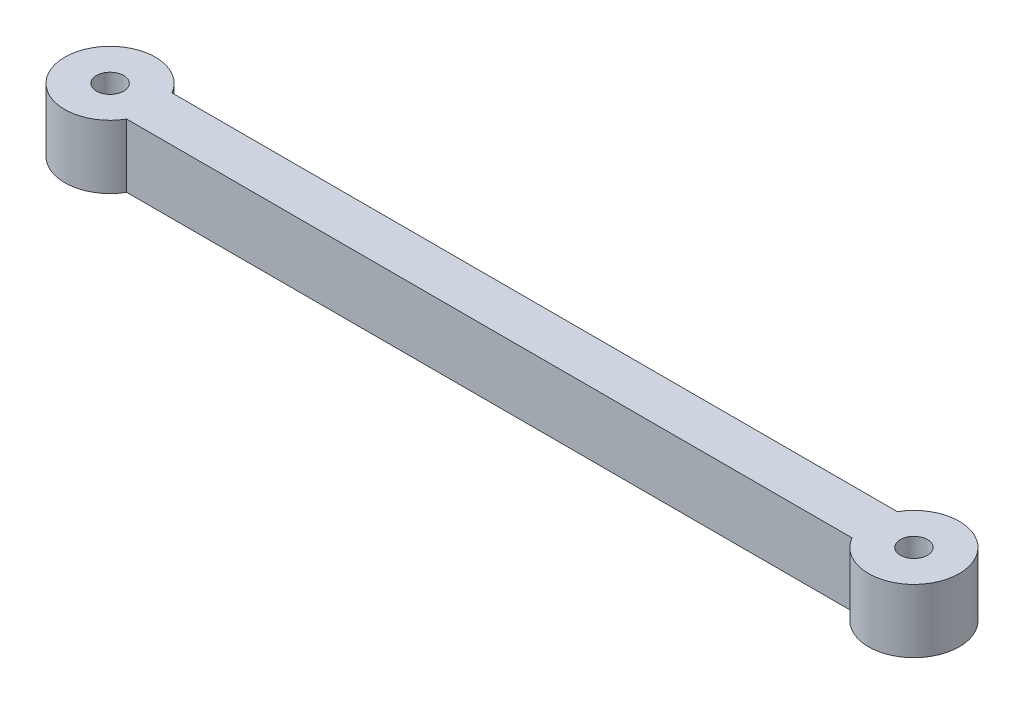
from build123d import *

# Parameters (mm, degrees)
BOSS_EXTRUDE1_DEPTH = 7
SKETCH2_R           = 1.5
CUT_EXTRUDE1_DEPTH  = 51.074558727


with BuildPart() as part:
    # Sketch1 → Boss-Extrude1 (new body)
    with BuildSketch(Plane(origin=(0, 0, 0), x_dir=(1, 0, 0), z_dir=(0, 1, 0))):
        with BuildLine():
            Line((-40, 2.5), (40, 2.5))
            ThreePointArc((40, 2.5), (49.330127019, 0), (40, -2.5))
            Line((40, -2.5), (-40, -2.5))
            ThreePointArc((-40, -2.5), (-49.330127019, 0), (-40, 2.5))
        make_face()
    extrude(amount=BOSS_EXTRUDE1_DEPTH)

    # Sketch2 → Cut-Extrude1 (cut, through all)
    with BuildSketch(Plane(origin=(0, 7, 0), x_dir=(1, 0, 0), z_dir=(0, 1, 0))):
        with Locations(Location((-44.330127019, 0, 0), (0, 0, 270))):
            Circle(SKETCH2_R)
        with Locations(Location((44.330127019, 0, 0), (0, 0, 270))):
            Circle(SKETCH2_R)
    extrude(amount=-CUT_EXTRUDE1_DEPTH, mode=Mode.SUBTRACT)


solid = part.part
